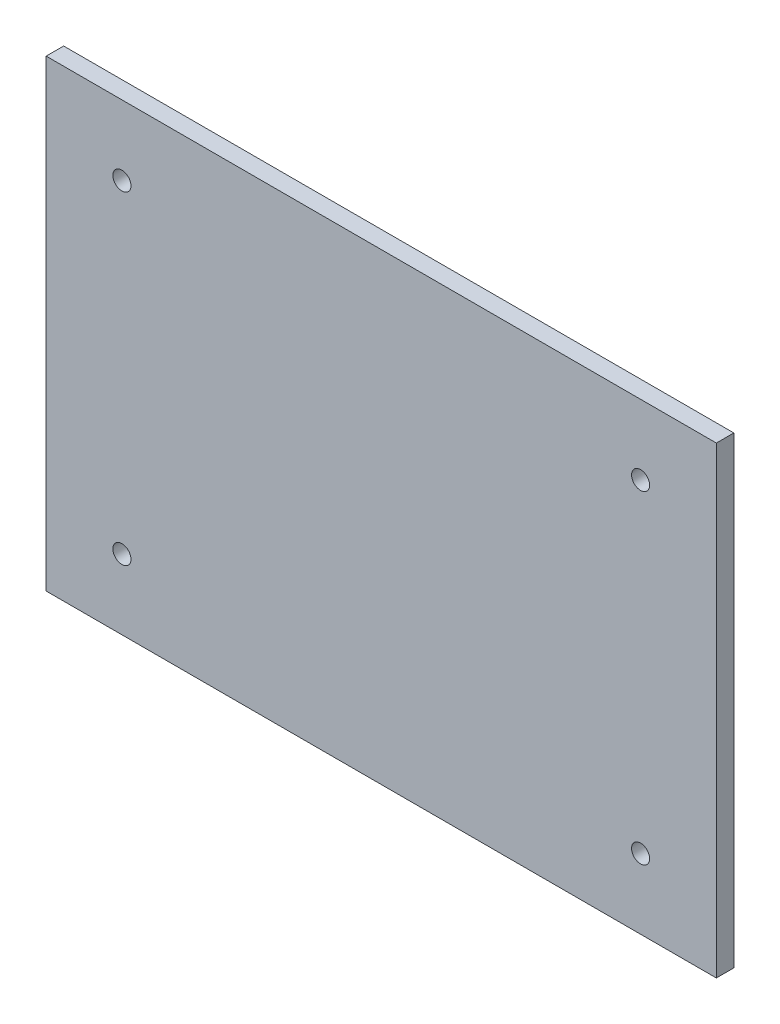
from build123d import *

# Parameters (mm, degrees)
CROQUIS1_W              = 115
CROQUIS1_H              = 79.5
SALIENTE_EXTRUIR1_DEPTH = 3
CROQUIS2_R              = 1.55
CORTAR_EXTRUIR1_DEPTH   = 3


with BuildPart() as part:
    # Croquis1 → Saliente-Extruir1 (new body)
    with BuildSketch(Plane.XY):
        Rectangle(CROQUIS1_W, CROQUIS1_H)
    extrude(amount=SALIENTE_EXTRUIR1_DEPTH)

    # Croquis2 → Cortar-Extruir1 (cut)
    with BuildSketch(Plane.XY.offset(3)):
        with Locations((-44.5, 27.75)):
            Circle(CROQUIS2_R)
        with Locations((44.5, 27.75)):
            Circle(CROQUIS2_R)
        with Locations((44.5, -27.75)):
            Circle(CROQUIS2_R)
        with Locations((-44.5, -27.75)):
            Circle(CROQUIS2_R)
    extrude(amount=-CORTAR_EXTRUIR1_DEPTH, mode=Mode.SUBTRACT)


solid = part.part
